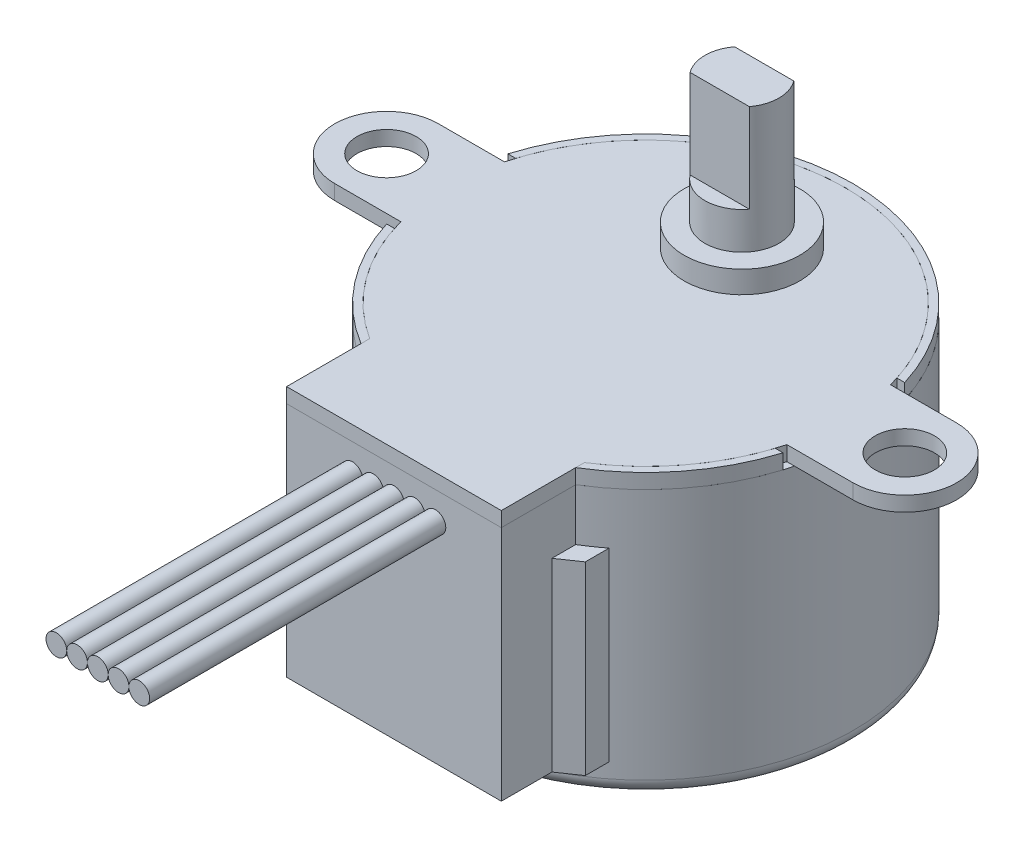
from build123d import *
from build123d.topology import SkipClean

# Parameters (mm, degrees)
SKETCH1_R                = 14
BOSS_EXTRUDE1_DEPTH      = 18
SKETCH2_R                = 2
BOSS_EXTRUDE2_DEPTH      = 1
BOSS_EXTRUDE3_DEPTH      = 1
BOSS_EXTRUDE3_2_DEPTH    = 1
BOSS_EXTRUDE3_3_DEPTH    = 1
BOSS_EXTRUDE4_START      = -1
BOSS_EXTRUDE4_DEPTH      = 16
TAGLIO_ESTRUSIONE1_START = -3.5
TAGLIO_ESTRUSIONE1_DEPTH = 3.5
SKETCH6_R                = 3.9
BOSS_EXTRUDE6_DEPTH      = 1.5
SKETCH7_R                = 2.5
BOSS_EXTRUDE7_DEPTH      = 2.5
BOSS_EXTRUDE8_DEPTH      = 6
SKETCH9_R                = 0.7
BOSS_EXTRUDE9_DEPTH      = 20
LPATTERN1_COUNT          = 5
LPATTERN1_PITCH          = 1.4
RACCORDO1_R              = 1


with BuildPart() as part:
    # Sketch1 → Boss-Extrude1 (new body)
    with BuildSketch(Plane(origin=(0, 0, 0), x_dir=(1, 0, 0), z_dir=(0, 1, 0))):
        with Locations(Location((0, 0, 0), (0, 0, 270))):
            Circle(SKETCH1_R)
    extrude(amount=BOSS_EXTRUDE1_DEPTH)

    # Raccordo1
    raccordo1_edges = [part.edges().sort_by_distance(p)[0] for p in [
        (0, 0, -14),
    ]]
    fillet(raccordo1_edges, radius=RACCORDO1_R)


with BuildPart() as body_2:
    # Sketch2 → Boss-Extrude2 (new body)
    with BuildSketch(Plane(origin=(0, 18, 0), x_dir=(1, 0, 0), z_dir=(0, 1, 0))):
        with BuildLine():
            Line((13.03840481, 3.5), (17.5, 3.5))
            ThreePointArc((17.5, 3.5), (21, 0), (17.5, -3.5))
            Line((17.5, -3.5), (13.03840481, -3.5))
            ThreePointArc((13.03840481, -3.5), (10.883939727, -7.986855202), (7.25, -11.388041974))
            Line((7.25, -11.388041974), (7.25, -17))
            Line((7.25, -17), (-7.25, -17))
            Line((-7.25, -17), (-7.25, -11.388041974))
            ThreePointArc((-7.25, -11.388041974), (-10.883939727, -7.986855202), (-13.03840481, -3.5))
            Line((-13.03840481, -3.5), (-17.5, -3.5))
            ThreePointArc((-17.5, -3.5), (-21, 0), (-17.5, 3.5))
            Line((-17.5, 3.5), (-13.03840481, 3.5))
            ThreePointArc((-13.03840481, 3.5), (0, 13.5), (13.03840481, 3.5))
        make_face()
        with Locations(Location((17.5, 0, 0), (0, 0, 270))):
            Circle(SKETCH2_R, mode=Mode.SUBTRACT)
        with Locations(Location((-17.5, 0, 0), (0, 0, 90))):
            Circle(SKETCH2_R, mode=Mode.SUBTRACT)
    extrude(amount=BOSS_EXTRUDE2_DEPTH)


with BuildPart() as body_3:
    # Sketch3 → Boss-Extrude3 (new body)
    with BuildSketch(Plane(origin=(0, 18, 0), x_dir=(1, 0, 0), z_dir=(0, 1, 0))):
        with BuildLine():
            Line((-13.39128033, 4.083333333), (-12.867488325, 4.083839396))
            ThreePointArc((-12.867488325, 4.083839396), (-0.013043048, 13.499993699), (12.859573089, 4.108695652))
            Line((12.859573089, 4.108695652), (13.383365095, 4.109201715))
            ThreePointArc((13.383365095, 4.109201715), (-0.013526124, 13.999993466), (-13.39128033, 4.083333333))
        make_face()
    extrude(amount=BOSS_EXTRUDE3_DEPTH)


with BuildPart() as body_4:
    # Sketch3 → Boss-Extrude3 2 (new body)
    with BuildSketch(Plane(origin=(0, 18, 0), x_dir=(1, 0, 0), z_dir=(0, 1, 0))):
        with BuildLine():
            Line((13.383520465, -4.108695652), (12.859573089, -4.108695652))
            ThreePointArc((12.859573089, -4.108695652), (10.693266721, -8.240391181), (7.25, -11.388041974))
            Line((7.25, -11.388041974), (7.25, -11.976539567))
            ThreePointArc((7.25, -11.976539567), (11.041344287, -8.607480255), (13.383520465, -4.108695652))
        make_face()
    extrude(amount=BOSS_EXTRUDE3_2_DEPTH)


with BuildPart() as body_5:
    # Sketch3 → Boss-Extrude3 3 (new body)
    with BuildSketch(Plane(origin=(0, 18, 0), x_dir=(1, 0, 0), z_dir=(0, 1, 0))):
        with BuildLine():
            Line((-12.859573089, -4.108695652), (-13.383520465, -4.108695652))
            ThreePointArc((-13.383520465, -4.108695652), (-11.041344287, -8.607480255), (-7.25, -11.976539567))
            Line((-7.25, -11.976539567), (-7.25, -11.388041974))
            ThreePointArc((-7.25, -11.388041974), (-10.693266721, -8.240391181), (-12.859573089, -4.108695652))
        make_face()
    extrude(amount=BOSS_EXTRUDE3_3_DEPTH)


with BuildPart() as body_6:
    # Sketch4 → Boss-Extrude4 (new body)
    with BuildSketch(Plane(origin=(0, 19, 0), x_dir=(1, 0, 0), z_dir=(0, 1, 0)).offset(BOSS_EXTRUDE4_START)):
        with BuildLine():
            Line((7.25, -17), (-7.25, -17))
            Line((-7.25, -17), (-7.25, -13.58308718))
            Line((-7.25, -13.58308718), (-8.58522732, -12.665203584))
            Line((-8.58522732, -12.665203584), (-8.58522732, -11.05865597))
            ThreePointArc((-8.58522732, -11.05865597), (0, -14), (8.58522732, -11.05865597))
            Line((8.58522732, -11.05865597), (8.58522732, -12.665203584))
            Line((8.58522732, -12.665203584), (7.25, -13.58308718))
            Line((7.25, -13.58308718), (7.25, -17))
        make_face()
    extrude(amount=-BOSS_EXTRUDE4_DEPTH)

    # Schizzo1 → Taglio-Estrusione1 (cut)
    with BuildSketch(Plane(origin=(0, 18, 0), x_dir=(1, 0, 0), z_dir=(0, 1, 0)).offset(TAGLIO_ESTRUSIONE1_START)):
        with BuildLine():
            Line((-7.25, -13.58308718), (-7.25, -11.976539567))
            ThreePointArc((-7.25, -11.976539567), (-7.930903709, -11.536930543), (-8.58522732, -11.05865597))
            Line((-8.58522732, -11.05865597), (-8.58522732, -12.665203584))
            Line((-8.58522732, -12.665203584), (-7.25, -13.58308718))
        make_face()
        with BuildLine():
            Line((7.25, -13.58308718), (7.25, -11.976539567))
            ThreePointArc((7.25, -11.976539567), (7.930903709, -11.536930543), (8.58522732, -11.05865597))
            Line((8.58522732, -11.05865597), (8.58522732, -12.665203584))
            Line((8.58522732, -12.665203584), (7.25, -13.58308718))
        make_face()
    extrude(amount=TAGLIO_ESTRUSIONE1_DEPTH, mode=Mode.SUBTRACT)


with BuildPart() as body_7:
    # Sketch6 → Boss-Extrude6 (new body)
    with BuildSketch(Plane(origin=(0, 19, 0), x_dir=(1, 0, 0), z_dir=(0, 1, 0))):
        with Locations(Location((0, 6.5, 0), (0, 0, 270))):
            Circle(SKETCH6_R)
    extrude(amount=BOSS_EXTRUDE6_DEPTH)


with BuildPart() as body_8:
    # Sketch7 → Boss-Extrude7 (new body)
    with BuildSketch(Plane(origin=(0, 20.5, 0), x_dir=(1, 0, 0), z_dir=(0, 1, 0))):
        with Locations(Location((0, 6.5, 0), (0, 0, 270))):
            Circle(SKETCH7_R)
    extrude(amount=BOSS_EXTRUDE7_DEPTH)

    # Sketch8 → Boss-Extrude8 (add)
    with SkipClean():  # the faces are left unmerged after this step: merging them gives an invalid solid
        with BuildSketch(Plane(origin=(0, 23, 0), x_dir=(1, 0, 0), z_dir=(0, 1, 0))):
            with BuildLine():
                Line((-2, 8), (2, 8))
                ThreePointArc((2, 8), (2.5, 6.5), (2, 5))
                Line((2, 5), (-2, 5))
                ThreePointArc((-2, 5), (-2.5, 6.5), (-2, 8))
            make_face()
        extrude(amount=BOSS_EXTRUDE8_DEPTH)


with BuildPart() as body_9:
    # Sketch9 → Boss-Extrude9 (new body)
    with BuildSketch(Plane.XY.offset(17)):
        with Locations((-2.8, 16.128230697)):
            Circle(SKETCH9_R)
    extrude(amount=BOSS_EXTRUDE9_DEPTH)


with BuildPart() as lpattern1_1:
    # LPattern1: pattern copy
    add(body_9.part.moved(Location(Vector(1, 0, 0) * (1 * LPATTERN1_PITCH))))


with BuildPart() as lpattern1_2:
    # LPattern1: pattern copy
    add(body_9.part.moved(Location(Vector(1, 0, 0) * (2 * LPATTERN1_PITCH))))


with BuildPart() as lpattern1_3:
    # LPattern1: pattern copy
    add(body_9.part.moved(Location(Vector(1, 0, 0) * (3 * LPATTERN1_PITCH))))


with BuildPart() as lpattern1_4:
    # LPattern1: pattern copy
    add(body_9.part.moved(Location(Vector(1, 0, 0) * (4 * LPATTERN1_PITCH))))


solid = Compound([part.part, body_2.part, body_3.part, body_4.part, body_5.part, body_6.part, body_7.part, body_8.part, body_9.part, lpattern1_1.part, lpattern1_2.part, lpattern1_3.part, lpattern1_4.part])
